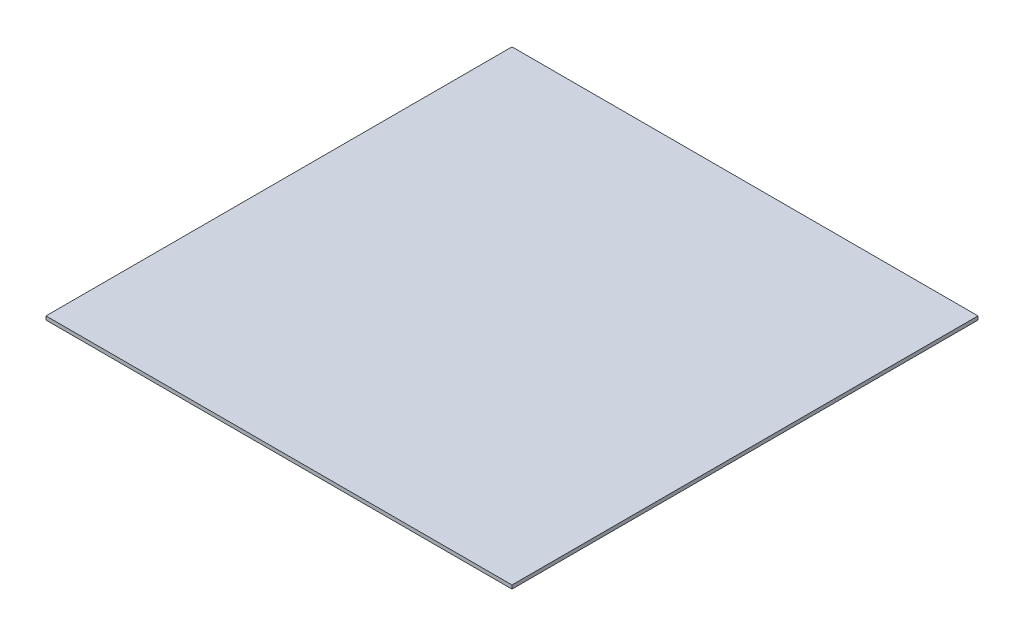
from build123d import *

# Parameters (mm, degrees)
SKETCH1_W           = 203.2
SKETCH1_H           = 203.2
BOSS_EXTRUDE1_DEPTH = 1.5875


with BuildPart() as part:
    # Sketch1 → Boss-Extrude1 (new body)
    with BuildSketch(Plane(origin=(0, 0, 0), x_dir=(1, 0, 0), z_dir=(0, 1, 0))):
        Rectangle(SKETCH1_W, SKETCH1_H)
    extrude(amount=BOSS_EXTRUDE1_DEPTH)


solid = part.part
